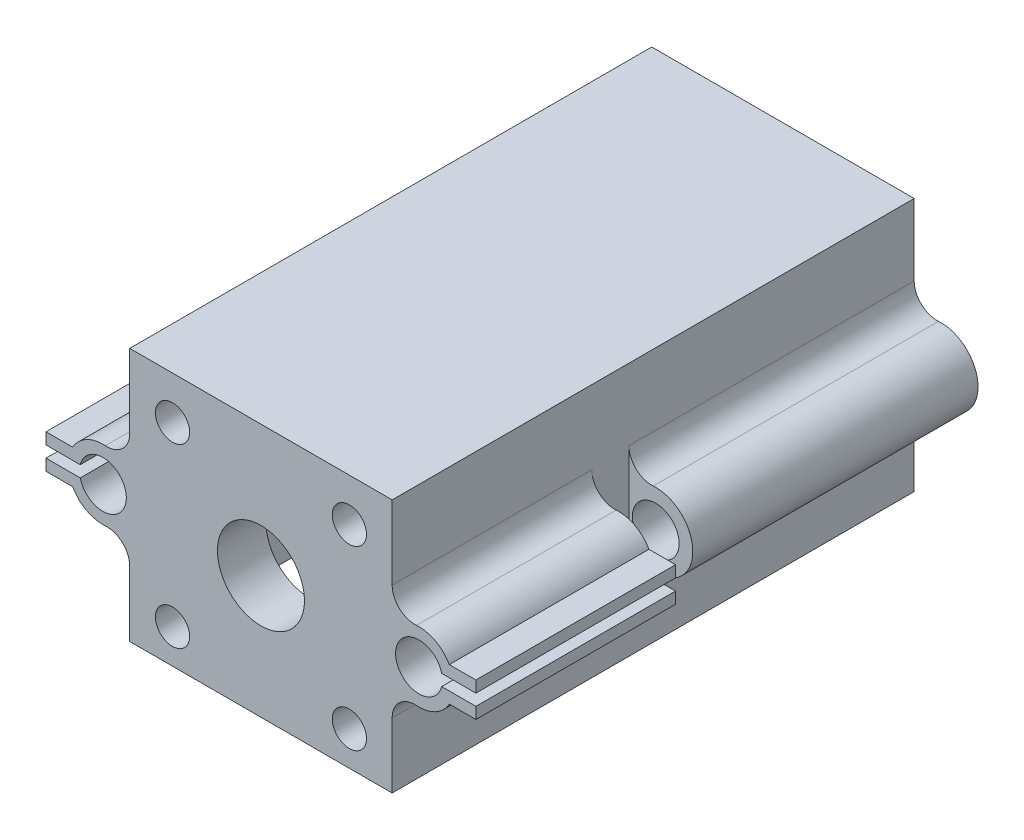
from build123d import *

# Parameters (mm, degrees)
CROQUIS2_W              = 43
CROQUIS2_H              = 43
CROQUIS2_R              = 1.6
SALIENTE_EXTRUIR2_DEPTH = 2.5
SALIENTE_EXTRUIR3_DEPTH = 1.5
SALIENTE_EXTRUIR4_DEPTH = 1.5
SALIENTE_EXTRUIR5_DEPTH = 1.5
CROQUIS7_W              = 46
CROQUIS7_H              = 8.5
SALIENTE_EXTRUIR6_DEPTH = 44.5
CROQUIS8_R              = 7.625
CORTAR_EXTRUIR1_DEPTH   = 90.145947749
CROQUIS9_R              = 3
CORTAR_EXTRUIR3_DEPTH   = 16.5
SALIENTE_EXTRUIR8_DEPTH = 1.5
SALIENTE_EXTRUIR9_DEPTH = 1.5
CROQUIS12_R             = 12.25
CUT_EXTRUDE1_DEPTH      = 10
BOSS_EXTRUDE1_DEPTH     = 35
BOSS_EXTRUDE2_START     = -50
SKETCH3_R               = 4.1
BOSS_EXTRUDE2_DEPTH     = 50
BOSS_EXTRUDE3_START     = -3
SKETCH4_R               = 4.1
BOSS_EXTRUDE3_DEPTH     = 3
FILLET1_R               = 4


with BuildPart() as part:
    # Croquis2 → Saliente-Extruir2 (new body)
    with BuildSketch(Plane.XY.offset(-84)):
        Rectangle(CROQUIS2_W, CROQUIS2_H)
        with Locations((-15.511143721, 15.511143721)):
            Circle(CROQUIS2_R, mode=Mode.SUBTRACT)
        with Locations((15.511143721, 15.511143721)):
            Circle(CROQUIS2_R, mode=Mode.SUBTRACT)
        with Locations((15.511143721, -15.511143721)):
            Circle(CROQUIS2_R, mode=Mode.SUBTRACT)
        with Locations((-15.511143721, -15.511143721)):
            Circle(CROQUIS2_R, mode=Mode.SUBTRACT)
    extrude(amount=SALIENTE_EXTRUIR2_DEPTH)

    # Croquis4 → Saliente-Extruir3 (add)
    with BuildSketch(Plane(origin=(0, 21.5, 0), x_dir=(1, 0, 0), z_dir=(0, 1, 0))):
        Polygon((-21.5, 84), (-21.5, 122), (21.5, 122), (21.5, 84), (21.5, 39), (-21.5, 39), align=None)
    extrude(amount=SALIENTE_EXTRUIR3_DEPTH)

    # Croquis5 → Saliente-Extruir4 (add)
    with BuildSketch(Plane.ZY.offset(21.5)):
        Polygon((-60.25, 21.5), (-39, 21.5), (-39, 23), (-122, 23), (-122, 21.5), (-122, -21.5), (-84, -21.5), (-81.5, -21.5), (-81.5, 0), (-81.5, 21.5), align=None)
    extrude(amount=SALIENTE_EXTRUIR4_DEPTH)

    # Croquis6 → Saliente-Extruir5 (add)
    with BuildSketch(Plane(origin=(21.5, 0, 0), x_dir=(0, 0, -1), z_dir=(1, 0, 0))):
        Polygon((122, 21.5), (122, -21.5), (84, -21.5), (81.5, -21.5), (81.5, 0), (81.5, 21.5), (64, 21.5), (39, 21.5), (39, 23), (122, 23), align=None)
    extrude(amount=SALIENTE_EXTRUIR5_DEPTH)

    # Croquis7 → Saliente-Extruir6 (add)
    with BuildSketch(Plane(origin=(0, 23, 0), x_dir=(1, 0, 0), z_dir=(0, 1, 0))):
        with Locations((0, 34.75)):
            Rectangle(CROQUIS7_W, CROQUIS7_H)
    extrude(amount=-SALIENTE_EXTRUIR6_DEPTH)

    # Croquis8 → Cortar-Extruir1 (cut, through all)
    with BuildSketch(Plane(origin=(0, 0, -39), x_dir=(-1, 0, 0), z_dir=(0, 0, -1))):
        Circle(CROQUIS8_R)
    extrude(amount=-CORTAR_EXTRUIR1_DEPTH, mode=Mode.SUBTRACT)

    # Croquis9 → Cortar-Extruir3 (cut)
    with BuildSketch(Plane.XY.offset(-30.5)):
        with Locations((-15.5, 15.5)):
            Circle(CROQUIS9_R)
        with Locations((15.5, 15.5)):
            Circle(CROQUIS9_R)
        with Locations((-15.5, -15.5)):
            Circle(CROQUIS9_R)
        with Locations((15.5, -15.5)):
            Circle(CROQUIS9_R)
    extrude(amount=-CORTAR_EXTRUIR3_DEPTH, mode=Mode.SUBTRACT)

    # Croquis10 → Saliente-Extruir8 (add)
    with BuildSketch(Plane.ZY.offset(23)):
        Polygon((-39, -21.5), (-39, 21.5), (-81.5, 21.5), (-81.5, 0), (-81.5, -21.5), align=None)
    extrude(amount=-SALIENTE_EXTRUIR8_DEPTH)

    # Croquis11 → Saliente-Extruir9 (add)
    with BuildSketch(Plane(origin=(23, 0, 0), x_dir=(0, 0, -1), z_dir=(1, 0, 0))):
        Polygon((39, 21.5), (81.5, 21.5), (81.5, 0), (81.5, -21.5), (39, -21.5), align=None)
    extrude(amount=-SALIENTE_EXTRUIR9_DEPTH)

    # Croquis12 → Cut-Extrude1 (cut)
    with BuildSketch(Plane.XY.offset(-81.5)):
        Circle(CROQUIS12_R)
    extrude(amount=-CUT_EXTRUDE1_DEPTH, mode=Mode.SUBTRACT)

    # Sketch2 → Boss-Extrude1 (add)
    with BuildSketch(Plane.XY.offset(-30.5)):
        with BuildLine():
            Line((-37.67617907, 1), (-37.67617907, 3))
            Line((-37.67617907, 3), (-33.01130869, 3))
            ThreePointArc((-33.01130869, 3), (-28.23921976, 6.076120641), (-23, 3.888444419))
            Line((-23, 3.888444419), (-23, -3.888444419))
            ThreePointArc((-23, -3.888444419), (-28.23921976, -6.076120641), (-33.01130869, -3))
            Line((-33.01130869, -3), (-37.67617907, -3))
            Line((-37.67617907, -3), (-37.67617907, -1))
            Line((-37.67617907, -1), (-31.67617907, -1))
            ThreePointArc((-31.67617907, -1), (-23.6, 0), (-31.67617907, 1))
            Line((-31.67617907, 1), (-37.67617907, 1))
        make_face()
        with BuildLine():
            Line((23, 3.888444419), (23, -3.888444419))
            ThreePointArc((23, -3.888444419), (28.23921976, -6.076120641), (33.01130869, -3))
            Line((33.01130869, -3), (37.67617907, -3))
            Line((37.67617907, -3), (37.67617907, -1))
            Line((37.67617907, -1), (31.67617907, -1))
            ThreePointArc((31.67617907, -1), (23.6, 0), (31.67617907, 1))
            Line((31.67617907, 1), (37.67617907, 1))
            Line((37.67617907, 1), (37.67617907, 3))
            Line((37.67617907, 3), (33.01130869, 3))
            ThreePointArc((33.01130869, 3), (28.23921976, 6.076120641), (23, 3.888444419))
        make_face()
    extrude(amount=-BOSS_EXTRUDE1_DEPTH)

    # Sketch3 → Boss-Extrude2 (add)
    # profile 1 of 2: a face of its own
    with BuildSketch(Plane(origin=(0, 0, -122), x_dir=(-1, 0, 0), z_dir=(0, 0, -1)).offset(BOSS_EXTRUDE2_START)):
        with BuildLine():
            Line((-23, -4.489988864), (-23, 4.489988864))
            ThreePointArc((-23, 4.489988864), (-34.2, 0), (-23, -4.489988864))
        make_face()
        with Locations((-27.7, 0)):
            Circle(SKETCH3_R, mode=Mode.SUBTRACT)
    # profile 2 of 2: a face of its own
    with BuildSketch(Plane(origin=(0, 0, -122), x_dir=(-1, 0, 0), z_dir=(0, 0, -1)).offset(BOSS_EXTRUDE2_START)):
        with BuildLine():
            ThreePointArc((23, -4.489988864), (34.2, 0), (23, 4.489988864))
            Line((23, 4.489988864), (23, -4.489988864))
        make_face()
        with Locations((27.7, 0)):
            Circle(SKETCH3_R, mode=Mode.SUBTRACT)
    extrude(amount=BOSS_EXTRUDE2_DEPTH)

    # Sketch4 → Boss-Extrude3 (add)
    with BuildSketch(Plane(origin=(0, 0, -122), x_dir=(-1, 0, 0), z_dir=(0, 0, -1)).offset(BOSS_EXTRUDE3_START)):
        with Locations((-27.7, 0)):
            Circle(SKETCH4_R)
        with Locations((27.7, 0)):
            Circle(SKETCH4_R)
    extrude(amount=BOSS_EXTRUDE3_DEPTH)

    # Fillet1
    fillet1_edges = [part.edges().sort_by_distance(p)[0] for p in [
        (-23, 3.888444419, -48),
        (-23, -3.888444419, -48),
        (23, 3.888444419, -48),
        (23, -3.888444419, -48),
        (23, 4.489988864, -97),
        (23, -4.489988864, -97),
        (-23, -4.489988864, -97),
        (-23, 4.489988864, -97),
    ]]
    fillet(fillet1_edges, radius=FILLET1_R)


solid = part.part
